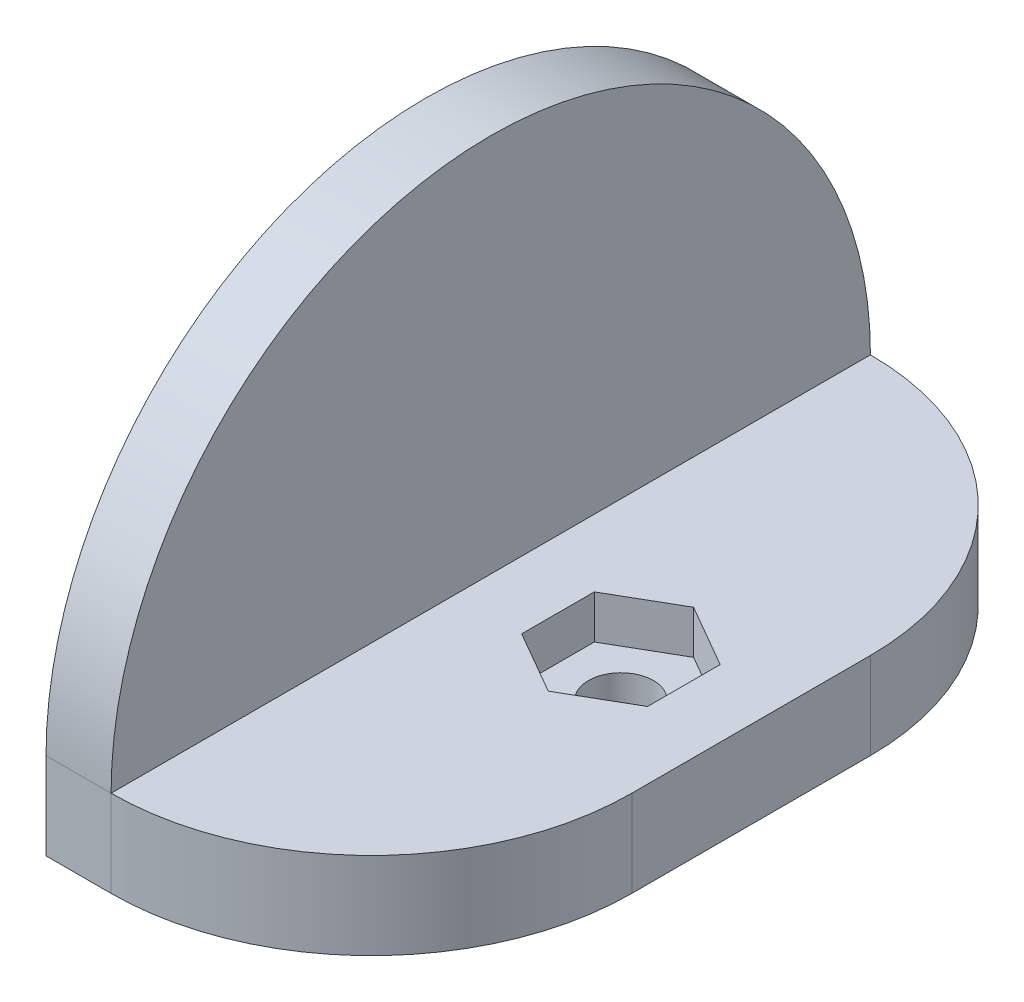
from build123d import *

# Parameters (mm, degrees)
SALIENTE_EXTRUIR1_DEPTH = 35
CORTAR_EXTRUIR1_DEPTH   = 2
CROQUIS4_R              = 1.5
CORTAR_EXTRUIR2_DEPTH   = 10
CORTAR_EXTRUIR3_DEPTH   = 10
CORTAR_EXTRUIR4_DEPTH   = 10


with BuildPart() as part:
    # Croquis2 → Saliente-Extruir1 (new body)
    with BuildSketch(Plane.XY):
        Polygon((0, 23), (3, 23), (3, 4), (15, 4), (15, 0), (0, 0), align=None)
    extrude(amount=SALIENTE_EXTRUIR1_DEPTH)

    # Croquis3 → Cortar-Extruir1 (cut)
    with BuildSketch(Plane(origin=(0, 4, 0), x_dir=(1, 0, 0), z_dir=(0, 1, 0))):
        Polygon((9, -14.151368439), (6.1, -15.825684219), (6.1, -19.174315781), (9, -20.848631561), (11.9, -19.174315781), (11.9, -15.825684219), align=None)
    extrude(amount=-CORTAR_EXTRUIR1_DEPTH, mode=Mode.SUBTRACT)

    # Croquis4 → Cortar-Extruir2 (cut)
    with BuildSketch(Plane(origin=(0, 2, 0), x_dir=(1, 0, 0), z_dir=(0, 1, 0))):
        with Locations(Location((9, -17.5, 0), (0, 0, 270))):
            Circle(CROQUIS4_R)
    extrude(amount=-CORTAR_EXTRUIR2_DEPTH, mode=Mode.SUBTRACT)

    # Croquis5 → Cortar-Extruir3 (cut)
    with BuildSketch(Plane(origin=(0, 4, 0), x_dir=(1, 0, 0), z_dir=(0, 1, 0))):
        with BuildLine():
            Line((15, -12), (15, -23))
            ThreePointArc((15, -23), (11.485281374, -31.485281374), (3, -35))
            Line((3, -35), (3, -39.861701289))
            Line((3, -39.861701289), (21.688312252, -36.848700447))
            Line((21.688312252, -36.848700447), (27.206798155, -6.851825545))
            Line((27.206798155, -6.851825545), (15.87267332, 7.755192399))
            Line((15.87267332, 7.755192399), (3, 0))
            ThreePointArc((3, 0), (11.485281374, -3.514718626), (15, -12))
        make_face()
    extrude(amount=-CORTAR_EXTRUIR3_DEPTH, mode=Mode.SUBTRACT)

    # Croquis6 → Cortar-Extruir4 (cut)
    with BuildSketch(Plane(origin=(3, 0, 0), x_dir=(0, 0, -1), z_dir=(1, 0, 0))):
        with BuildLine():
            Line((-35, 4), (-43.463242579, 10.305944429))
            Line((-43.463242579, 10.305944429), (-37.648578304, 30.185339472))
            Line((-37.648578304, 30.185339472), (-37.331119495, 31.270679702))
            Line((-37.331119495, 31.270679702), (8.796856155, 26.447825939))
            Line((8.796856155, 26.447825939), (6.381141064, 12.03440645))
            Line((6.381141064, 12.03440645), (0, 4))
            ThreePointArc((0, 4), (-17.5, 21.5), (-35, 4))
        make_face()
    extrude(amount=-CORTAR_EXTRUIR4_DEPTH, mode=Mode.SUBTRACT)


solid = part.part
